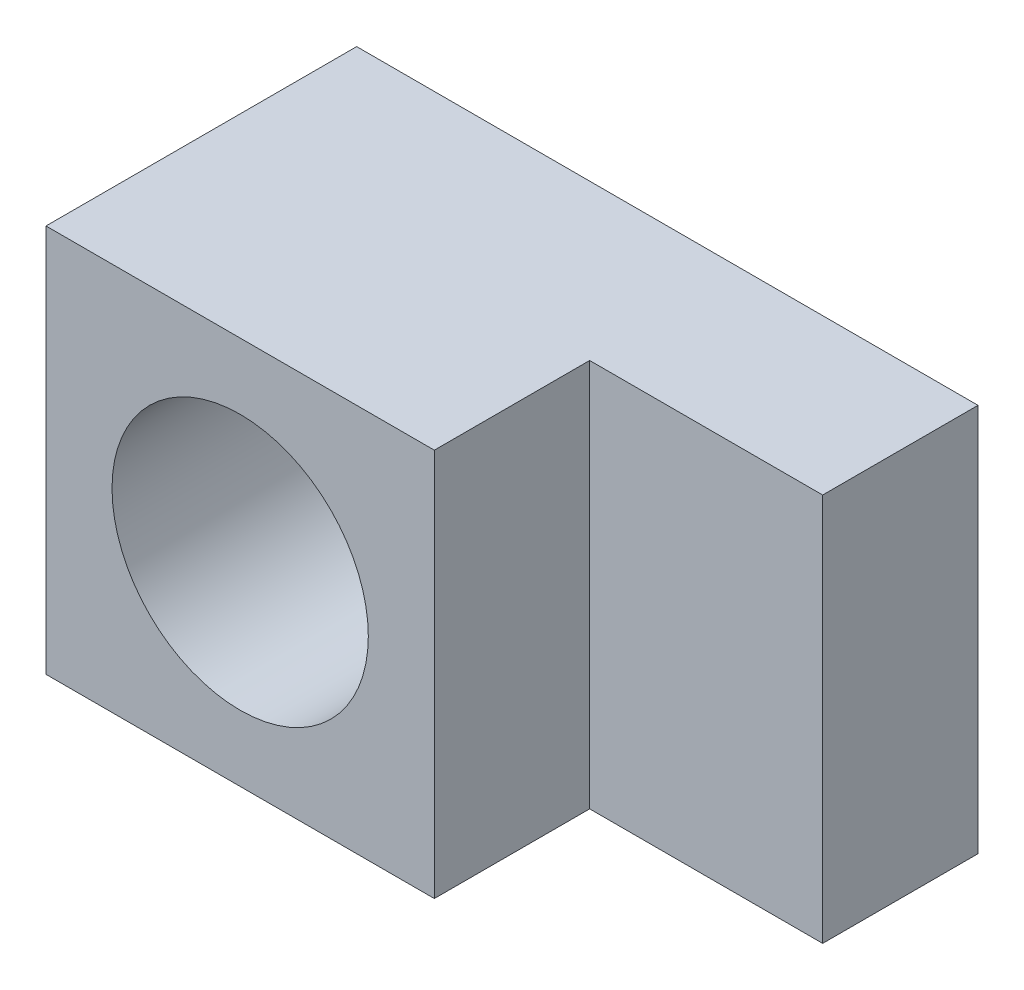
from build123d import *

# Parameters (mm, degrees)
SKETCH_1_W          = 8
SKETCH_1_H          = 5
EXTRUDE_1_DEPTH     = 4
SKETCH_2_W          = 2
SKETCH_2_H          = 5
CUT_EXTRUDE_1_DEPTH = 3
SKETCH_3_R          = 1.65
CUT_EXTRUDE_2_DEPTH = 5


with BuildPart() as part:
    # Эскиз1 → Бобышка-Вытянуть1 (new body)
    with BuildSketch(Plane.XY):
        Rectangle(SKETCH_1_W, SKETCH_1_H)
    extrude(amount=EXTRUDE_1_DEPTH)

    # Эскиз2 → Вырез-Вытянуть1 (cut)
    with BuildSketch(Plane(origin=(4, 0, 0), x_dir=(0, 0, -1), z_dir=(1, 0, 0))):
        with Locations((-3, 0)):
            Rectangle(SKETCH_2_W, SKETCH_2_H)
    extrude(amount=-CUT_EXTRUDE_1_DEPTH, mode=Mode.SUBTRACT)

    # Эскиз3 → Вырез-Вытянуть2 (cut)
    with BuildSketch(Plane.XY.offset(4)):
        with Locations((-1.5, 0)):
            Circle(SKETCH_3_R)
    extrude(amount=-CUT_EXTRUDE_2_DEPTH, mode=Mode.SUBTRACT)


solid = part.part
